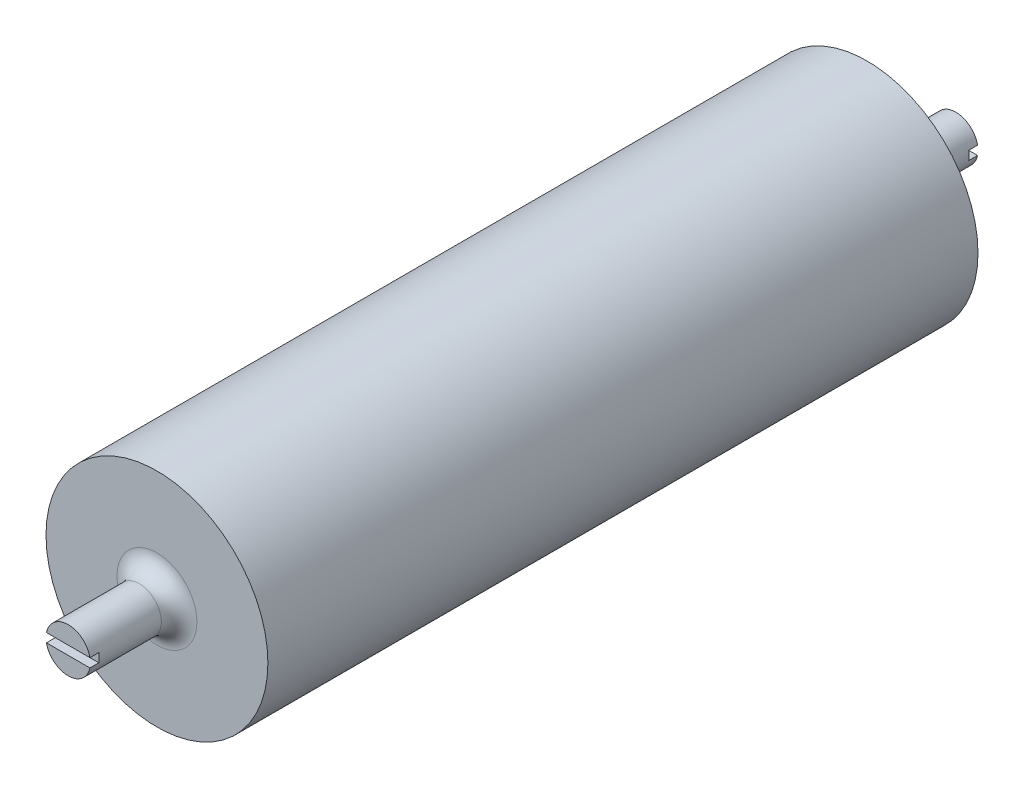
from build123d import *

# Parameters (mm, degrees)
ESQUISSE1_R             = 12.5
BOSS_EXTRU_1_DEPTH      = 80
BOSS_EXTRU_2_DEPTH      = 90
BOSS_EXTRU_2_DEPTH_BACK = 10
ESQUISSE2_R             = 2.5
CONG_1_R                = 2
CONG_2_R                = 2
ENL_V_START             = -5
ESQUISSE3_R             = 0.5
ENL_V_MAT_EXTRU_1_DEPTH = 90
ENL_V_MAT_EXTRU_2_DEPTH = 1
ENL_V_MAT_EXTRU_3_DEPTH = 1


with BuildPart() as part:
    # Esquisse1 → Boss.-Extru.1 (new body)
    with BuildSketch(Plane.XY):
        Circle(ESQUISSE1_R)
    extrude(amount=BOSS_EXTRU_1_DEPTH)

    # Esquisse2 → Boss.-Extru.2 (add, two sides: drawn at the far end of the back side and taken through both)
    with BuildSketch(Plane.XY.offset(-BOSS_EXTRU_2_DEPTH_BACK)):
        with Locations(Location((0, 0, 0), (0, 0, 180))):
            Circle(ESQUISSE2_R)
    extrude(amount=BOSS_EXTRU_2_DEPTH + BOSS_EXTRU_2_DEPTH_BACK)

    # Congé1
    cong_1_edges = [part.edges().sort_by_distance(p)[0] for p in [
        (2.5, 0, 80),
    ]]
    fillet(cong_1_edges, radius=CONG_1_R)

    # Congé2
    cong_2_edges = [part.edges().sort_by_distance(p)[0] for p in [
        (2.5, 0, 0),
    ]]
    fillet(cong_2_edges, radius=CONG_2_R)

    # Esquisse3 → Enlèv. mat.-Extru.1 (cut)
    with BuildSketch(Plane.XY.offset(90).offset(ENL_V_START)):
        Circle(ESQUISSE3_R)
    extrude(amount=-ENL_V_MAT_EXTRU_1_DEPTH, mode=Mode.SUBTRACT)

    # Esquisse4 → Enlèv. mat.-Extru.2 (cut)
    with BuildSketch(Plane(origin=(0, 0, -10), x_dir=(-1, 0, 0), z_dir=(0, 0, -1))):
        with BuildLine():
            Line((-2.449489743, -0.5), (2.449489743, -0.5))
            ThreePointArc((2.449489743, -0.5), (2.5, 0), (2.449489743, 0.5))
            Line((2.449489743, 0.5), (-2.449489743, 0.5))
            ThreePointArc((-2.449489743, 0.5), (-2.5, 0), (-2.449489743, -0.5))
        make_face()
    extrude(amount=-ENL_V_MAT_EXTRU_2_DEPTH, mode=Mode.SUBTRACT)

    # Esquisse5 → Enlèv. mat.-Extru.3 (cut)
    with BuildSketch(Plane.XY.offset(90)):
        with BuildLine():
            Line((-2.449489743, -0.5), (2.449489743, -0.5))
            ThreePointArc((2.449489743, -0.5), (2.5, 0), (2.449489743, 0.5))
            Line((2.449489743, 0.5), (-2.449489743, 0.5))
            ThreePointArc((-2.449489743, 0.5), (-2.5, 0), (-2.449489743, -0.5))
        make_face()
    extrude(amount=-ENL_V_MAT_EXTRU_3_DEPTH, mode=Mode.SUBTRACT)


solid = part.part
